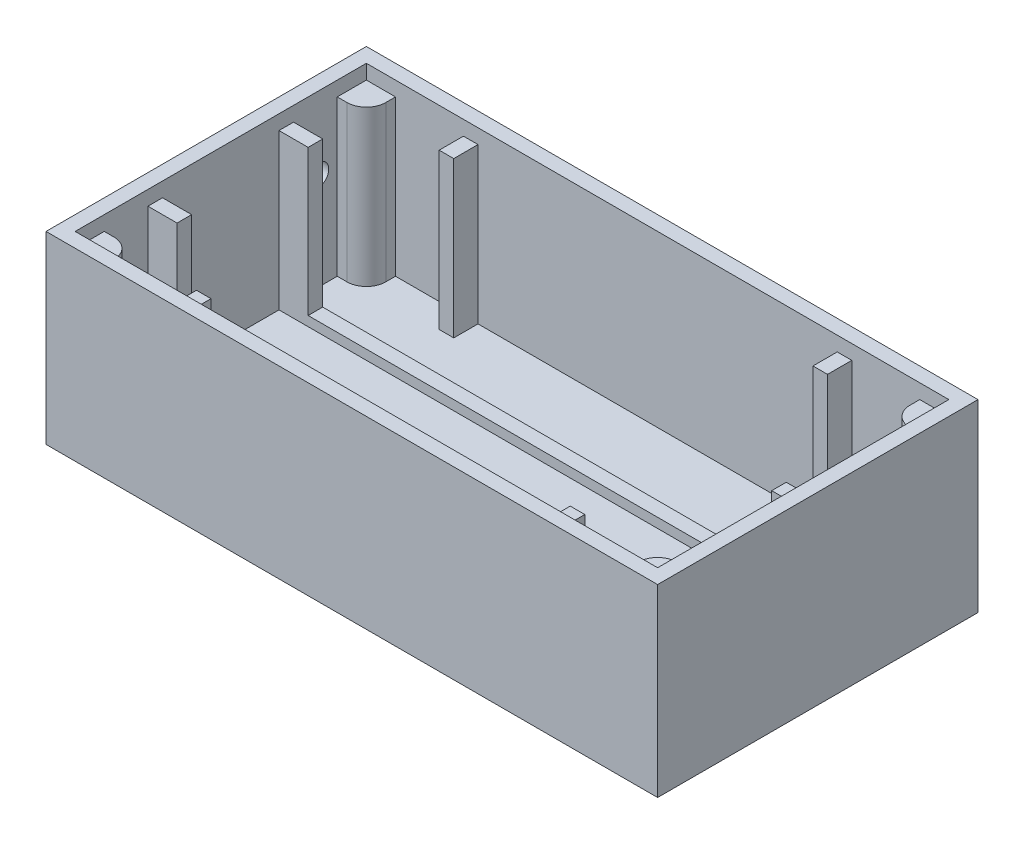
from build123d import *

# Parameters (mm, degrees)
SKETCH_3_W          = 126
SKETCH_3_H          = 66
SKETCH_3_W_2        = 120
SKETCH_3_H_2        = 60
EXTRUDE_2_DEPTH     = 35
SKETCH_4_W          = 6
SKETCH_4_H          = 3
SKETCH_4_W_2        = 5
SKETCH_4_W_3        = 3
SKETCH_4_H_2        = 5
EXTRUDE_3_DEPTH     = 35
SKETCH_5_W          = 120
SKETCH_5_H          = 60
CUT_EXTRUDE_1_DEPTH = 3
EXTRUDE_4_DEPTH     = 32
SKETCH_7_W          = 126
SKETCH_7_H          = 66
EXTRUDE_5_DEPTH     = 3
SKETCH_8_W          = 3
SKETCH_8_H          = 2
EXTRUDE_6_DEPTH     = 114
SKETCH_10_R         = 2.25
CUT_EXTRUDE_2_DEPTH = 3


with BuildPart() as part:
    # Эскиз3 → Бобышка-Вытянуть2 (new body)
    with BuildSketch(Plane(origin=(0, 0, 0), x_dir=(1, 0, 0), z_dir=(0, 1, 0))):
        with Locations((63, 33)):
            Rectangle(SKETCH_3_W, SKETCH_3_H)
        with Locations((63, 33)):
            Rectangle(SKETCH_3_W_2, SKETCH_3_H_2, mode=Mode.SUBTRACT)
    extrude(amount=EXTRUDE_2_DEPTH)

    # Эскиз4 → Бобышка-Вытянуть3 (add)
    with BuildSketch(Plane(origin=(0, 35, 0), x_dir=(1, 0, 0), z_dir=(0, 1, 0))):
        with Locations((6, 19.5)):
            Rectangle(SKETCH_4_W, SKETCH_4_H)
        with Locations((6, 46.5)):
            Rectangle(SKETCH_4_W, SKETCH_4_H)
        with Locations((120.5, 33)):
            Rectangle(SKETCH_4_W_2, SKETCH_4_H)
        with Locations((24.5, 60.5)):
            Rectangle(SKETCH_4_W_3, SKETCH_4_H_2)
        with Locations((101.5, 60.5)):
            Rectangle(SKETCH_4_W_3, SKETCH_4_H_2)
        with Locations((101.5, 5.5)):
            Rectangle(SKETCH_4_W_3, SKETCH_4_H_2)
        with Locations((24.5, 5.5)):
            Rectangle(SKETCH_4_W_3, SKETCH_4_H_2)
    extrude(amount=-EXTRUDE_3_DEPTH)

    # Эскиз5 → Вырез-Вытянуть1 (cut)
    with BuildSketch(Plane(origin=(0, 35, 0), x_dir=(1, 0, 0), z_dir=(0, 1, 0))):
        with Locations((63, 33)):
            Rectangle(SKETCH_5_W, SKETCH_5_H)
    extrude(amount=-CUT_EXTRUDE_1_DEPTH, mode=Mode.SUBTRACT)

    # Эскиз6 → Бобышка-Вытянуть4 (add)
    with BuildSketch(Plane.XZ):
        with BuildLine():
            Line((3, -63), (9, -63))
            Line((9, -63), (9, -61))
            ThreePointArc((9, -61), (7.828427125, -58.171572875), (5, -57))
            Line((5, -57), (3, -57))
            Line((3, -57), (3, -63))
        make_face()
        with BuildLine():
            Line((3, -9), (5, -9))
            ThreePointArc((5, -9), (7.828427125, -7.828427125), (9, -5))
            Line((9, -5), (9, -3))
            Line((9, -3), (3, -3))
            Line((3, -3), (3, -9))
        make_face()
        with BuildLine():
            Line((123, -3), (117, -3))
            Line((117, -3), (117, -5))
            ThreePointArc((117, -5), (118.171572875, -7.828427125), (121, -9))
            Line((121, -9), (123, -9))
            Line((123, -9), (123, -3))
        make_face()
        with BuildLine():
            Line((123, -57), (121, -57))
            ThreePointArc((121, -57), (118.171572875, -58.171572875), (117, -61))
            Line((117, -61), (117, -63))
            Line((117, -63), (123, -63))
            Line((123, -63), (123, -57))
        make_face()
    extrude(amount=-EXTRUDE_4_DEPTH)

    # Эскиз7 → Бобышка-Вытянуть5 (add)
    with BuildSketch(Plane.XZ):
        with Locations((63, -33)):
            Rectangle(SKETCH_7_W, SKETCH_7_H)
    extrude(amount=EXTRUDE_5_DEPTH)

    # Эскиз8 → Бобышка-Вытянуть6 (add)
    with BuildSketch(Plane(origin=(9, 0, 0), x_dir=(0, 0, -1), z_dir=(1, 0, 0))):
        with Locations((19.5, 1)):
            Rectangle(SKETCH_8_W, SKETCH_8_H)
        with Locations((46.5, 1)):
            Rectangle(SKETCH_8_W, SKETCH_8_H)
    extrude(amount=EXTRUDE_6_DEPTH)

    # Эскиз10 → Вырез-Вытянуть2 (cut)
    with BuildSketch(Plane.ZY):
        with Locations((-53, 20)):
            Circle(SKETCH_10_R)
        with Locations((-13, 20)):
            Circle(SKETCH_10_R)
    extrude(amount=-CUT_EXTRUDE_2_DEPTH, mode=Mode.SUBTRACT)


solid = part.part
